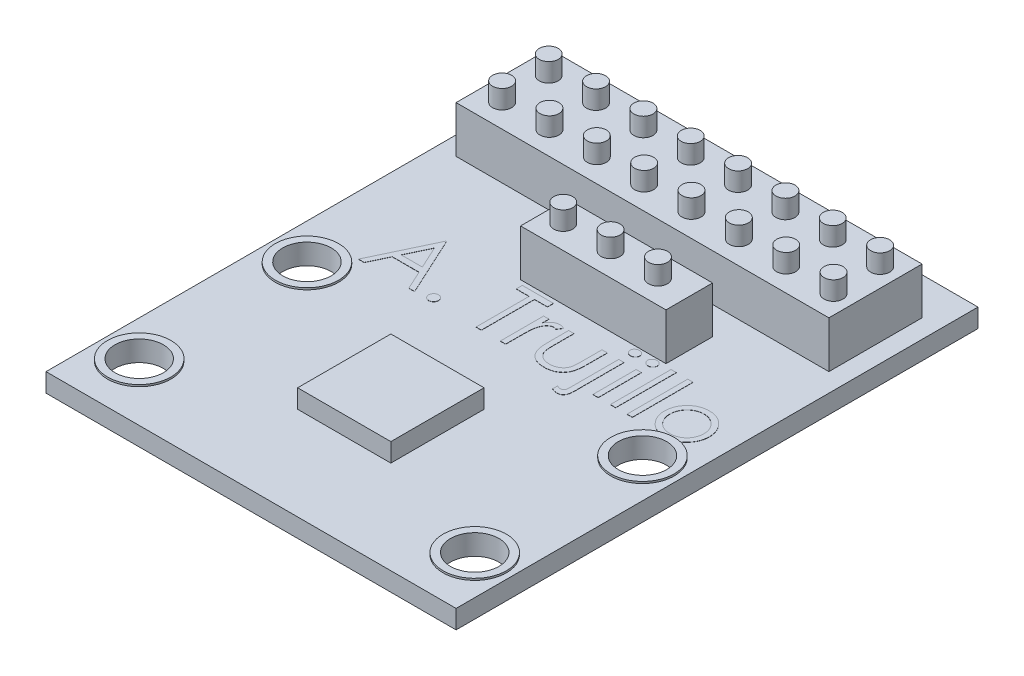
from build123d import *

# Parameters (mm, degrees)
SKETCH1_W           = 22
SKETCH1_H           = 28
BOSS_EXTRUDE1_DEPTH = 1
SKETCH2_W           = 20
SKETCH2_H           = 5
BOSS_EXTRUDE2_DEPTH = 2.5
SKETCH3_R           = 0.51
BOSS_EXTRUDE3_DEPTH = 1
SKETCH4_W           = 5
SKETCH4_H           = 5
BOSS_EXTRUDE4_DEPTH = 1
SKETCH5_R           = 1.3
CUT_EXTRUDE1_DEPTH  = 1
BOSS_EXTRUDE5_START = 0.1
SKETCH6_R           = 1.7
SKETCH6_R_2         = 1.3
BOSS_EXTRUDE5_DEPTH = 0.1
SKETCH7_W           = 7.8
SKETCH7_H           = 2.5
BOSS_EXTRUDE6_DEPTH = 2.5
SKETCH8_R           = 0.51
BOSS_EXTRUDE7_DEPTH = 1
SKETCH9_W           = 0.284935898
SKETCH9_H           = 2.320192308
SKETCH9_W_2         = 0.284935897
SKETCH9_H_2         = 3.256410256
BOSS_EXTRUDE8_DEPTH = 0.01


with BuildPart() as part:
    # Sketch1 → Boss-Extrude1 (new body)
    with BuildSketch(Plane(origin=(0, 0, 0), x_dir=(1, 0, 0), z_dir=(0, 1, 0))):
        Rectangle(SKETCH1_W, SKETCH1_H)
    extrude(amount=BOSS_EXTRUDE1_DEPTH)

    # Sketch2 → Boss-Extrude2 (add)
    with BuildSketch(Plane(origin=(0, 1, 0), x_dir=(1, 0, 0), z_dir=(0, 1, 0))):
        with Locations((0, 9.5)):
            Rectangle(SKETCH2_W, SKETCH2_H)
    extrude(amount=BOSS_EXTRUDE2_DEPTH)

    # Sketch3 → Boss-Extrude3 (add)
    with BuildSketch(Plane(origin=(0, 3.5, 0), x_dir=(1, 0, 0), z_dir=(0, 1, 0))):
        with Locations(Location((9, 8.25, 0), (0, 0, 270))):
            Circle(SKETCH3_R)
        with Locations(Location((6.46, 8.25, 0), (0, 0, 270))):
            Circle(SKETCH3_R)
        with Locations(Location((3.92, 8.25, 0), (0, 0, 270))):
            Circle(SKETCH3_R)
        with Locations(Location((1.38, 8.25, 0), (0, 0, 270))):
            Circle(SKETCH3_R)
        with Locations(Location((-1.16, 8.25, 0), (0, 0, 270))):
            Circle(SKETCH3_R)
        with Locations(Location((-3.7, 8.25, 0), (0, 0, 270))):
            Circle(SKETCH3_R)
        with Locations(Location((-6.24, 8.25, 0), (0, 0, 270))):
            Circle(SKETCH3_R)
        with Locations(Location((-8.78, 8.25, 0), (0, 0, 270))):
            Circle(SKETCH3_R)
        with Locations(Location((-8.78, 10.75, 0), (0, 0, 90))):
            Circle(SKETCH3_R)
        with Locations(Location((-6.24, 10.75, 0), (0, 0, 90))):
            Circle(SKETCH3_R)
        with Locations(Location((-3.7, 10.75, 0), (0, 0, 90))):
            Circle(SKETCH3_R)
        with Locations(Location((-1.16, 10.75, 0), (0, 0, 90))):
            Circle(SKETCH3_R)
        with Locations(Location((1.38, 10.75, 0), (0, 0, 90))):
            Circle(SKETCH3_R)
        with Locations(Location((3.92, 10.75, 0), (0, 0, 90))):
            Circle(SKETCH3_R)
        with Locations(Location((6.46, 10.75, 0), (0, 0, 90))):
            Circle(SKETCH3_R)
        with Locations(Location((9, 10.75, 0), (0, 0, 90))):
            Circle(SKETCH3_R)
    extrude(amount=BOSS_EXTRUDE3_DEPTH)

    # Sketch4 → Boss-Extrude4 (add)
    with BuildSketch(Plane(origin=(0, 1, 0), x_dir=(1, 0, 0), z_dir=(0, 1, 0))):
        with Locations((0, -6.5)):
            Rectangle(SKETCH4_W, SKETCH4_H)
    extrude(amount=BOSS_EXTRUDE4_DEPTH)

    # Sketch5 → Cut-Extrude1 (cut)
    with BuildSketch(Plane(origin=(0, 1, 0), x_dir=(1, 0, 0), z_dir=(0, 1, 0))):
        with Locations(Location((-9, -2, 0), (0, 0, 270))):
            Circle(SKETCH5_R)
        with Locations(Location((9, -2, 0), (0, 0, 90))):
            Circle(SKETCH5_R)
        with Locations(Location((9, -11, 0), (0, 0, 270))):
            Circle(SKETCH5_R)
        with Locations(Location((-9, -11, 0), (0, 0, 90))):
            Circle(SKETCH5_R)
    extrude(amount=-CUT_EXTRUDE1_DEPTH, mode=Mode.SUBTRACT)

    # Sketch6 → Boss-Extrude5 (add)
    # profile 1 of 4: a face of its own
    with BuildSketch(Plane(origin=(0, 1, 0), x_dir=(1, 0, 0), z_dir=(0, 1, 0)).offset(BOSS_EXTRUDE5_START)):
        with Locations(Location((-9, -2, 0), (0, 0, 270))):
            Circle(SKETCH6_R)
        with Locations(Location((-9, -2, 0), (0, 0, 270))):
            Circle(SKETCH6_R_2, mode=Mode.SUBTRACT)
    # profile 2 of 4: a face of its own
    with BuildSketch(Plane(origin=(0, 1, 0), x_dir=(1, 0, 0), z_dir=(0, 1, 0)).offset(BOSS_EXTRUDE5_START)):
        with Locations(Location((9, -2, 0), (0, 0, 270))):
            Circle(SKETCH6_R)
        with Locations(Location((9, -2, 0), (0, 0, 270))):
            Circle(SKETCH6_R_2, mode=Mode.SUBTRACT)
    # profile 3 of 4: a face of its own
    with BuildSketch(Plane(origin=(0, 1, 0), x_dir=(1, 0, 0), z_dir=(0, 1, 0)).offset(BOSS_EXTRUDE5_START)):
        with Locations(Location((-9, -11, 0), (0, 0, 270))):
            Circle(SKETCH6_R)
        with Locations(Location((-9, -11, 0), (0, 0, 270))):
            Circle(SKETCH6_R_2, mode=Mode.SUBTRACT)
    # profile 4 of 4: a face of its own
    with BuildSketch(Plane(origin=(0, 1, 0), x_dir=(1, 0, 0), z_dir=(0, 1, 0)).offset(BOSS_EXTRUDE5_START)):
        with Locations(Location((9, -11, 0), (0, 0, 270))):
            Circle(SKETCH6_R)
        with Locations(Location((9, -11, 0), (0, 0, 270))):
            Circle(SKETCH6_R_2, mode=Mode.SUBTRACT)
    extrude(amount=-BOSS_EXTRUDE5_DEPTH)

    # Sketch7 → Boss-Extrude6 (add)
    with BuildSketch(Plane(origin=(0, 1, 0), x_dir=(1, 0, 0), z_dir=(0, 1, 0))):
        with Locations((1.36, 4.25)):
            Rectangle(SKETCH7_W, SKETCH7_H)
    extrude(amount=BOSS_EXTRUDE6_DEPTH)

    # Sketch8 → Boss-Extrude7 (add)
    with BuildSketch(Plane(origin=(0, 3.5, 0), x_dir=(1, 0, 0), z_dir=(0, 1, 0))):
        with Locations(Location((-1.5, 4.25, 0), (0, 0, 270))):
            Circle(SKETCH8_R)
        with Locations(Location((1.04, 4.25, 0), (0, 0, 270))):
            Circle(SKETCH8_R)
        with Locations(Location((3.58, 4.25, 0), (0, 0, 270))):
            Circle(SKETCH8_R)
    extrude(amount=BOSS_EXTRUDE7_DEPTH)

    # Sketch9 → Boss-Extrude8 (add)
    # profile 1 of 12: a face of its own
    with BuildSketch(Plane(origin=(0, 1, 0), x_dir=(1, 0, 0), z_dir=(0, 1, 0))):
        Polygon((-6.290384615, 2.775), (-4.825, -0.4), (-5.134740585, -0.4), (-5.604121595, 0.617628205), (-7.043429487, 0.617628205), (-7.526166867, -0.4), (-7.837179487, -0.4), (-6.331089744, 2.775), align=None)
        Polygon((-6.313917268, 2.156154848), (-6.888877204, 0.943269231), (-5.754221755, 0.943269231), align=None, mode=Mode.SUBTRACT)
    # profile 2 of 12: a face of its own
    with BuildSketch(Plane(origin=(0, 1, 0), x_dir=(1, 0, 0), z_dir=(0, 1, 0))):
        with BuildLine():
            add(Edge.make_bspline(
                [(-4.03125, 0.088461538), (-4.013569593, 0.087410916), (-3.978909223, 0.085351293), (-3.928799442, 0.071221025), (-3.883447144, 0.046130668), (-3.843050036, 0.012690862), (-3.809752018, -0.027854489), (-3.783767498, -0.072845064), (-3.769760319, -0.123374365), (-3.767715699, -0.158235571), (-3.766666667, -0.176121795)],
                knots=[0, 0, 0, 0, 1.020151414, 1.999887582, 2.974338812, 3.990962822, 5.007586832, 5.987933904, 6.967670073, 8, 8, 8, 8], degree=3))
            add(Edge.make_bspline(
                [(-3.766666667, -0.176121795), (-3.767751247, -0.193578244), (-3.769890025, -0.228002105), (-3.78373539, -0.278150289), (-3.80995005, -0.323168981), (-3.842820365, -0.364264492), (-3.88345713, -0.397775139), (-3.928906662, -0.42265203), (-3.978791589, -0.437794041), (-4.013549968, -0.439722896), (-4.03125, -0.440705128)],
                knots=[0, 0, 0, 0, 1.009421747, 1.99056486, 2.972319754, 3.999869655, 5.017953583, 5.993804169, 6.978383603, 8, 8, 8, 8], degree=3))
            add(Edge.make_bspline(
                [(-4.03125, -0.440705128), (-4.048962786, -0.439758436), (-4.083542784, -0.437910246), (-4.133241507, -0.422341129), (-4.178967828, -0.398008419), (-4.219596681, -0.364202008), (-4.252742295, -0.323380449), (-4.277802464, -0.277840248), (-4.292852099, -0.228145659), (-4.294831369, -0.193606518), (-4.295833333, -0.176121795)],
                knots=[0, 0, 0, 0, 1.022052826, 1.995314843, 2.982371812, 4.00089066, 5.028879526, 6.005146991, 6.990147033, 8, 8, 8, 8], degree=3))
            add(Edge.make_bspline(
                [(-4.295833333, -0.176121795), (-4.294869858, -0.158206286), (-4.292988789, -0.123228454), (-4.277770869, -0.073154978), (-4.252936734, -0.027645037), (-4.219367554, 0.012629004), (-4.178977657, 0.0463632), (-4.133351814, 0.070914834), (-4.083423088, 0.085465779), (-4.048942644, 0.087445633), (-4.03125, 0.088461538)],
                knots=[0, 0, 0, 0, 1.032775665, 2.016367738, 2.991239715, 4.008302682, 5.025365648, 6.011011707, 6.979408107, 8, 8, 8, 8], degree=3))
        make_face()
    # profile 3 of 12: a face of its own
    with BuildSketch(Plane(origin=(0, 1, 0), x_dir=(1, 0, 0), z_dir=(0, 1, 0))):
        Polygon((-2.219871795, 2.449358974), (-2.219871795, 2.775), (-0.550961538, 2.775), (-0.550961538, 2.449358974), (-1.242948718, 2.449358974), (-1.242948718, -0.4), (-1.527884615, -0.4), (-1.527884615, 2.449358974), align=None)
    # profile 4 of 12: a face of its own
    with BuildSketch(Plane(origin=(0, 1, 0), x_dir=(1, 0, 0), z_dir=(0, 1, 0))):
        with BuildLine():
            Line((-0.225320513, 1.920192308), (0.059615385, 1.920192308))
            Line((0.059615385, 1.920192308), (0.059615385, 1.578650841))
            add(Edge.make_bspline(
                [(0.059615385, 1.578650841), (0.080650901, 1.610451486), (0.120881164, 1.671269971), (0.187749321, 1.751705694), (0.256241629, 1.818303629), (0.326685978, 1.871374678), (0.399600397, 1.911119436), (0.473384632, 1.940232403), (0.549199522, 1.957447539), (0.60014641, 1.95974593), (0.625671074, 1.960897436)],
                knots=[0, 0, 0, 0, 1.2804753, 2.448899062, 3.506932113, 4.484331642, 5.4025378, 6.288909075, 7.142734305, 8, 8, 8, 8], degree=3))
            add(Edge.make_bspline(
                [(0.625671074, 1.960897436), (0.64547067, 1.959817458), (0.686209626, 1.957595334), (0.747879547, 1.941982657), (0.811418964, 1.917056165), (0.852369558, 1.893615392), (0.873717949, 1.881395232)],
                knots=[0, 0, 0, 0, 0.901110191, 1.854092781, 2.881294221, 4, 4, 4, 4], degree=3))
            Line((0.873717949, 1.881395232), (0.717257612, 1.634620393))
            add(Edge.make_bspline(
                [(0.717257612, 1.634620393), (0.703551572, 1.640734777), (0.677534883, 1.652341049), (0.639476098, 1.666077015), (0.604386599, 1.674165024), (0.582031371, 1.675390318), (0.571609575, 1.675961538)],
                knots=[0, 0, 0, 0, 1.180555205, 2.24091978, 3.179933427, 4, 4, 4, 4], degree=3))
            add(Edge.make_bspline(
                [(0.571609575, 1.675961538), (0.548744374, 1.674437505), (0.502105992, 1.671328917), (0.433630767, 1.64689157), (0.367185088, 1.607407959), (0.31441508, 1.563619165), (0.273555322, 1.521393663), (0.244399546, 1.484519755), (0.217654483, 1.443173425), (0.192100069, 1.398061498), (0.168817073, 1.348413709), (0.147086766, 1.294726079), (0.127439083, 1.236936427), (0.116235648, 1.196675141), (0.110496795, 1.176051683)],
                knots=[0, 0, 0, 0, 1.125678352, 2.296057538, 3.5422874, 4.923748041, 5.663163013, 6.437101912, 7.23742474, 8.08941207, 8.991984279, 9.93940061, 10.944477711, 12, 12, 12, 12], degree=3))
            add(Edge.make_bspline(
                [(0.110496795, 1.176051683), (0.106203838, 1.15765739), (0.096695265, 1.116915428), (0.087450084, 1.048563552), (0.078315593, 0.967806376), (0.071877946, 0.874419109), (0.065910722, 0.768634964), (0.062545148, 0.650292785), (0.059730156, 0.519271102), (0.059654802, 0.427672938), (0.059615385, 0.379757612)],
                knots=[0, 0, 0, 0, 0.566838948, 1.255505196, 2.06880316, 3.007127437, 4.065329342, 5.249902469, 6.561414163, 8, 8, 8, 8], degree=3))
            Line((0.059615385, 0.379757612), (0.059615385, -0.4))
            Line((0.059615385, -0.4), (-0.225320513, -0.4))
            Line((-0.225320513, -0.4), (-0.225320513, 1.920192308))
        make_face()
    # profile 5 of 12: a face of its own
    with BuildSketch(Plane(origin=(0, 1, 0), x_dir=(1, 0, 0), z_dir=(0, 1, 0))):
        with BuildLine():
            Line((1.117948718, 1.920192308), (1.402884615, 1.920192308))
            Line((1.402884615, 1.920192308), (1.402884615, 0.844050481))
            add(Edge.make_bspline(
                [(1.402884615, 0.844050481), (1.403013343, 0.812461273), (1.403259594, 0.752032597), (1.40492959, 0.665078249), (1.408857604, 0.585778803), (1.413768716, 0.514088448), (1.420084368, 0.450019315), (1.42759856, 0.393795184), (1.435997271, 0.34477846), (1.444218447, 0.315256987), (1.448041867, 0.301527444)],
                knots=[0, 0, 0, 0, 1.388932606, 2.656963016, 3.823490214, 4.879454478, 5.816252168, 6.653371382, 7.373723809, 8, 8, 8, 8], degree=3))
            add(Edge.make_bspline(
                [(1.448041867, 0.301527444), (1.454175473, 0.284270982), (1.466315168, 0.250116817), (1.488334685, 0.200778219), (1.515574676, 0.155080642), (1.545383234, 0.111261947), (1.579763411, 0.070620145), (1.618280217, 0.033223867), (1.659644332, -0.002339845), (1.721107818, -0.044417477), (1.805163009, -0.089516384), (1.915519437, -0.128429019), (2.035175413, -0.15168437), (2.117874837, -0.154382444), (2.160381611, -0.155769231)],
                knots=[0, 0, 0, 0, 0.725840625, 1.436591201, 2.137033971, 2.831655856, 3.53531722, 4.242432219, 4.957935707, 5.694543706, 7.190802206, 8.724350549, 10.316345118, 12, 12, 12, 12], degree=3))
            add(Edge.make_bspline(
                [(2.160381611, -0.155769231), (2.202884435, -0.154352955), (2.285119537, -0.151612724), (2.403460831, -0.129130514), (2.5116389, -0.091569639), (2.608567977, -0.039130058), (2.693808418, 0.025043099), (2.764841712, 0.100343946), (2.823449721, 0.184390176), (2.849039696, 0.247095772), (2.861909054, 0.278630809)],
                knots=[0, 0, 0, 0, 1.157059328, 2.238695713, 3.266970494, 4.264342957, 5.228770407, 6.160125903, 7.074715775, 8, 8, 8, 8], degree=3))
            add(Edge.make_bspline(
                [(2.861909054, 0.278630809), (2.86571382, 0.291300237), (2.874125228, 0.319309249), (2.883162504, 0.366825163), (2.891303623, 0.423489483), (2.898255219, 0.489673001), (2.903212902, 0.565202761), (2.905885369, 0.650055158), (2.90890459, 0.743963821), (2.908950415, 0.809702431), (2.908974359, 0.844050481)],
                knots=[0, 0, 0, 0, 0.557542046, 1.232589297, 2.036731608, 2.971723315, 4.038036528, 5.22795436, 6.551621927, 8, 8, 8, 8], degree=3))
            Line((2.908974359, 0.844050481), (2.908974359, 1.920192308))
            Line((2.908974359, 1.920192308), (3.193910256, 1.920192308))
            Line((3.193910256, 1.920192308), (3.193910256, 0.790625))
            add(Edge.make_bspline(
                [(3.193910256, 0.790625), (3.193509576, 0.752246352), (3.192732202, 0.677786524), (3.187736254, 0.569578794), (3.179164106, 0.468738758), (3.166153241, 0.375213037), (3.150853665, 0.289073036), (3.131117617, 0.210208352), (3.107551645, 0.138861971), (3.080967356, 0.073781931), (3.049560376, 0.014775105), (3.016153008, -0.0412281), (2.977576965, -0.092838119), (2.936963966, -0.142624058), (2.89178675, -0.188109587), (2.842891878, -0.230338425), (2.790967547, -0.269956104), (2.734861489, -0.305417479), (2.675392775, -0.337364007), (2.61248799, -0.36568145), (2.545376656, -0.388090216), (2.474924642, -0.407422034), (2.400786778, -0.422584446), (2.323034536, -0.433276545), (2.241694106, -0.439830953), (2.186259096, -0.440408843), (2.15783754, -0.440705128)],
                knots=[0, 0, 0, 0, 1.493040784, 2.896703357, 4.213163133, 5.428574705, 6.569057535, 7.615249723, 8.588095153, 9.490268104, 10.346124644, 11.18633936, 12.024365274, 12.850166724, 13.684164916, 14.514361689, 15.362232829, 16.222528818, 17.093394965, 17.986930858, 18.902426812, 19.842810585, 20.827885679, 21.843828298, 22.894529745, 24, 24, 24, 24], degree=3))
            add(Edge.make_bspline(
                [(2.15783754, -0.440705128), (2.129628559, -0.440396965), (2.074195286, -0.439791396), (1.992850658, -0.433312757), (1.914882993, -0.422601059), (1.840569489, -0.407310969), (1.769835571, -0.388225527), (1.702394725, -0.365543748), (1.639036636, -0.337349311), (1.579000104, -0.30561967), (1.52275508, -0.269728313), (1.470042299, -0.230387306), (1.42093244, -0.187655377), (1.375414671, -0.141710989), (1.334127899, -0.091984196), (1.296557633, -0.03887501), (1.262125479, 0.017090342), (1.23096259, 0.077019068), (1.204191212, 0.142852249), (1.180555382, 0.215693187), (1.161223589, 0.29634047), (1.145491492, 0.384725148), (1.132835543, 0.480424221), (1.124048828, 0.583991284), (1.119135896, 0.695174061), (1.118352976, 0.771963605), (1.117948718, 0.811613582)],
                knots=[0, 0, 0, 0, 1.083640291, 2.129454052, 3.13281866, 4.105697902, 5.042300162, 5.946461698, 6.836384745, 7.703652036, 8.553297018, 9.397182691, 10.228592656, 11.052265423, 11.879314572, 12.708807002, 13.549817954, 14.402308542, 15.300838682, 16.27712199, 17.341985831, 18.484375296, 19.725102775, 21.0496083, 22.476576903, 24, 24, 24, 24], degree=3))
            Line((1.117948718, 0.811613582), (1.117948718, 1.920192308))
        make_face()
    # profile 6 of 12: a face of its own
    with BuildSketch(Plane(origin=(0, 1, 0), x_dir=(1, 0, 0), z_dir=(0, 1, 0))):
        with BuildLine():
            add(Edge.make_bspline(
                [(3.946955128, 2.897115385), (3.964844632, 2.896301242), (3.999673067, 2.894716217), (4.049844476, 2.881099846), (4.094985299, 2.857386423), (4.135408102, 2.826583645), (4.169313863, 2.789305864), (4.193927924, 2.746840161), (4.208489214, 2.700234886), (4.210508366, 2.668038142), (4.211538462, 2.65161258)],
                knots=[0, 0, 0, 0, 1.06928763, 2.081757757, 3.080304056, 4.102817284, 5.108909582, 6.075019406, 7.017947647, 8, 8, 8, 8], degree=3))
            add(Edge.make_bspline(
                [(4.211538462, 2.65161258), (4.210488325, 2.63561376), (4.20841659, 2.604050893), (4.193938765, 2.558247277), (4.169108267, 2.516376936), (4.135430802, 2.479171593), (4.09497934, 2.448386481), (4.04984607, 2.424668402), (3.999672639, 2.411053277), (3.964844487, 2.409468078), (3.946955128, 2.408653846)],
                knots=[0, 0, 0, 0, 0.962634111, 1.899108286, 2.860048811, 3.872254101, 4.900980094, 5.905593535, 6.924215405, 8, 8, 8, 8], degree=3))
            add(Edge.make_bspline(
                [(3.946955128, 2.408653846), (3.929065769, 2.409468078), (3.894237617, 2.411053277), (3.844064186, 2.424668402), (3.798930916, 2.448386481), (3.758479455, 2.479171593), (3.72480199, 2.516376936), (3.699971492, 2.558247277), (3.685493667, 2.604050893), (3.683421931, 2.63561376), (3.682371795, 2.65161258)],
                knots=[0, 0, 0, 0, 1.075784595, 2.094406465, 3.099019906, 4.127745899, 5.139951189, 6.100891714, 7.037365889, 8, 8, 8, 8], degree=3))
            add(Edge.make_bspline(
                [(3.682371795, 2.65161258), (3.68340189, 2.668038142), (3.685421042, 2.700234886), (3.699982332, 2.746840161), (3.724596393, 2.789305864), (3.758502154, 2.826583645), (3.798924958, 2.857386423), (3.844065781, 2.881099846), (3.89423719, 2.894716217), (3.929065624, 2.896301242), (3.946955128, 2.897115385)],
                knots=[0, 0, 0, 0, 0.982052353, 1.924980594, 2.891090418, 3.897182716, 4.919695944, 5.918242243, 6.93071237, 8, 8, 8, 8], degree=3))
        make_face()
    # profile 7 of 12: a face of its own
    with BuildSketch(Plane(origin=(0, 1, 0), x_dir=(1, 0, 0), z_dir=(0, 1, 0))):
        with BuildLine():
            Line((3.804487179, 1.920192308), (4.089423077, 1.920192308))
            Line((4.089423077, 1.920192308), (4.089423077, -0.738997396))
            add(Edge.make_bspline(
                [(4.089423077, -0.738997396), (4.089332128, -0.762543685), (4.089157362, -0.807790032), (4.08355857, -0.873126571), (4.076295731, -0.933703109), (4.065705325, -0.989449357), (4.051692947, -1.040319581), (4.034491536, -1.085988372), (4.015142869, -1.127421868), (3.991180759, -1.163108424), (3.965126068, -1.194427666), (3.936750989, -1.221527429), (3.906210926, -1.244748826), (3.872788376, -1.262979637), (3.837570782, -1.278101428), (3.799803261, -1.287846972), (3.760003002, -1.294698271), (3.73264868, -1.295236754), (3.7186248, -1.295512821)],
                knots=[0, 0, 0, 0, 1.493029139, 2.868991889, 4.156754484, 5.362105958, 6.464967428, 7.499106053, 8.455465818, 9.358121702, 10.217355437, 11.035397588, 11.842309395, 12.643033568, 13.444773531, 14.266895717, 15.11148054, 16, 16, 16, 16], degree=3))
            add(Edge.make_bspline(
                [(3.7186248, -1.295512821), (3.693966134, -1.294660842), (3.643002913, -1.292900019), (3.564737446, -1.277501864), (3.481894906, -1.254874533), (3.426311346, -1.233483404), (3.397435897, -1.222370793)],
                knots=[0, 0, 0, 0, 0.892368802, 1.844300437, 2.88012224, 4, 4, 4, 4], degree=3))
            Line((3.397435897, -1.222370793), (3.397435897, -0.948247196))
            add(Edge.make_bspline(
                [(3.397435897, -0.948247196), (3.41545271, -0.957855682), (3.449830753, -0.976189721), (3.50244422, -0.994748605), (3.551728083, -1.008347444), (3.584131659, -1.009853719), (3.599689503, -1.010576923)],
                knots=[0, 0, 0, 0, 1.144578483, 2.183980519, 3.128079311, 4, 4, 4, 4], degree=3))
            add(Edge.make_bspline(
                [(3.599689503, -1.010576923), (3.617677073, -1.009421716), (3.652367083, -1.007193836), (3.700738004, -0.987968404), (3.741514316, -0.955337613), (3.76033218, -0.926010723), (3.770142228, -0.910722155)],
                knots=[0, 0, 0, 0, 1.036054724, 1.998088038, 2.956371939, 4, 4, 4, 4], degree=3))
            add(Edge.make_bspline(
                [(3.770142228, -0.910722155), (3.775712416, -0.897297287), (3.788746637, -0.86588314), (3.797650118, -0.807107044), (3.803895746, -0.732378348), (3.804277615, -0.676696339), (3.804487179, -0.646138822)],
                knots=[0, 0, 0, 0, 0.647276487, 1.514624746, 2.636060416, 4, 4, 4, 4], degree=3))
            Line((3.804487179, -0.646138822), (3.804487179, 1.920192308))
        make_face()
    # profile 8 of 12: a face of its own
    with BuildSketch(Plane(origin=(0, 1, 0), x_dir=(1, 0, 0), z_dir=(0, 1, 0))):
        with BuildLine():
            add(Edge.make_bspline(
                [(4.881901042, 2.897115385), (4.89958245, 2.896295189), (4.934206042, 2.894689089), (4.984274221, 2.880935463), (5.02986451, 2.857622177), (5.070302882, 2.826344181), (5.105002808, 2.789560043), (5.129296738, 2.746687593), (5.14491084, 2.700370114), (5.146796387, 2.66806214), (5.14775641, 2.65161258)],
                knots=[0, 0, 0, 0, 1.055194115, 2.066272739, 3.074728998, 4.095836921, 5.109056067, 6.073838105, 7.019297344, 8, 8, 8, 8], degree=3))
            add(Edge.make_bspline(
                [(5.14775641, 2.65161258), (5.146774737, 2.63559003), (5.144834084, 2.603915346), (5.129308798, 2.558400839), (5.104795768, 2.516124096), (5.070325133, 2.479411381), (5.029858614, 2.448150675), (4.984275787, 2.424832805), (4.93420563, 2.411080395), (4.89958231, 2.409474127), (4.881901042, 2.408653846)],
                knots=[0, 0, 0, 0, 0.96129708, 1.900370562, 2.859976407, 3.87933698, 4.906634145, 5.921202961, 6.938410037, 8, 8, 8, 8], degree=3))
            add(Edge.make_bspline(
                [(4.881901042, 2.408653846), (4.864421963, 2.409442807), (4.830401221, 2.410978415), (4.781082729, 2.425102646), (4.735881171, 2.448158655), (4.695363932, 2.479206694), (4.661590828, 2.516349565), (4.637008776, 2.558375039), (4.621519346, 2.603921915), (4.619573861, 2.635592237), (4.618589744, 2.65161258)],
                knots=[0, 0, 0, 0, 1.054934014, 2.053291228, 3.073705704, 4.106921865, 5.123545215, 6.088680038, 7.033164197, 8, 8, 8, 8], degree=3))
            add(Edge.make_bspline(
                [(4.618589744, 2.65161258), (4.619552301, 2.668059851), (4.621442824, 2.700363328), (4.637020386, 2.746713822), (4.661386069, 2.789332756), (4.695386294, 2.826548745), (4.735875219, 2.857614247), (4.781084267, 2.880665637), (4.830400815, 2.894791066), (4.864421826, 2.896326509), (4.881901042, 2.897115385)],
                knots=[0, 0, 0, 0, 0.98631895, 1.937192651, 2.907499808, 3.917963147, 4.944918757, 5.95915025, 6.951458133, 8, 8, 8, 8], degree=3))
        make_face()
    # profile 9 of 12: a face of its own
    with BuildSketch(Plane(origin=(0, 1, 0), x_dir=(1, 0, 0), z_dir=(0, 1, 0))):
        with Locations((4.883173077, 0.760096154)):
            Rectangle(SKETCH9_W, SKETCH9_H)
    # profile 10 of 12: a face of its own
    with BuildSketch(Plane(origin=(0, 1, 0), x_dir=(1, 0, 0), z_dir=(0, 1, 0))):
        with Locations((5.819391025, 1.228205128)):
            Rectangle(SKETCH9_W_2, SKETCH9_H_2)
    # profile 11 of 12: a face of its own
    with BuildSketch(Plane(origin=(0, 1, 0), x_dir=(1, 0, 0), z_dir=(0, 1, 0))):
        with Locations((6.714903846, 1.228205128)):
            Rectangle(SKETCH9_W, SKETCH9_H_2)
    # profile 12 of 12: a face of its own
    with BuildSketch(Plane(origin=(0, 1, 0), x_dir=(1, 0, 0), z_dir=(0, 1, 0))):
        with BuildLine():
            add(Edge.make_bspline(
                [(8.629316907, 1.960897436), (8.672851847, 1.959970435), (8.758213226, 1.958152812), (8.883224665, 1.938726379), (9.002554896, 1.909019841), (9.116660942, 1.867952067), (9.224081438, 1.812904869), (9.326381067, 1.747219298), (9.423279353, 1.669402231), (9.481357387, 1.609205983), (9.51083734, 1.578650841)],
                knots=[0, 0, 0, 0, 1.054011418, 2.066658804, 3.057071809, 4.030435133, 4.997543892, 5.974964718, 6.972108034, 8, 8, 8, 8], degree=3))
            add(Edge.make_bspline(
                [(9.51083734, 1.578650841), (9.53622097, 1.549428154), (9.586496986, 1.49154832), (9.650963745, 1.397699299), (9.706500446, 1.300507922), (9.751007561, 1.198683562), (9.786100404, 1.09311511), (9.811015714, 0.983439714), (9.825835648, 0.869899585), (9.827834053, 0.79278896), (9.828846154, 0.753735978)],
                knots=[0, 0, 0, 0, 1.025258237, 2.030674902, 3.01204498, 3.988269485, 4.97094183, 5.956517959, 6.965070386, 8, 8, 8, 8], degree=3))
            add(Edge.make_bspline(
                [(9.828846154, 0.753735978), (9.827955941, 0.71445664), (9.826196838, 0.636838836), (9.809556557, 0.522521268), (9.783674787, 0.411673108), (9.746634476, 0.304758435), (9.699138192, 0.201450442), (9.641180211, 0.102200351), (9.572353815, 0.006812344), (9.494335904, -0.083903609), (9.408110273, -0.167511532), (9.314569196, -0.240380748), (9.215550894, -0.302811703), (9.109738709, -0.353100451), (8.998098917, -0.392751394), (8.88039072, -0.420600694), (8.756796978, -0.437438793), (8.672407998, -0.439601034), (8.629316907, -0.440705128)],
                knots=[0, 0, 0, 0, 0.998656419, 1.973391657, 2.932242238, 3.890759089, 4.846373663, 5.82037756, 6.809684879, 7.83454468, 8.860553229, 9.859544525, 10.845671541, 11.83227036, 12.833544569, 13.85385346, 14.904124723, 16, 16, 16, 16], degree=3))
            add(Edge.make_bspline(
                [(8.629316907, -0.440705128), (8.586014697, -0.439597329), (8.501205132, -0.437427648), (8.377175134, -0.420666113), (8.259255979, -0.392764228), (8.147470036, -0.352970146), (8.041202925, -0.302810095), (7.941610889, -0.240569491), (7.847993823, -0.167489922), (7.761749951, -0.083909465), (7.68373693, 0.006813853), (7.614909273, 0.102199959), (7.55695162, 0.201450544), (7.509455249, 0.304758408), (7.472414962, 0.411673115), (7.446533185, 0.522521266), (7.429892906, 0.636838836), (7.428133803, 0.71445664), (7.42724359, 0.753735978)],
                knots=[0, 0, 0, 0, 1.099876186, 2.154163076, 3.173186993, 4.173200201, 5.163417411, 6.152872554, 7.150605724, 8.17532212, 9.198891216, 10.186952605, 11.159729845, 12.11414092, 13.071450619, 14.029093627, 15.002601286, 16, 16, 16, 16], degree=3))
            add(Edge.make_bspline(
                [(7.42724359, 0.753735978), (7.428262593, 0.792576701), (7.430280043, 0.869474659), (7.445085077, 0.98280135), (7.469903196, 1.092291124), (7.505038105, 1.197452092), (7.549955457, 1.298830237), (7.604711768, 1.396261763), (7.669836128, 1.48968641), (7.719912184, 1.54749144), (7.745252404, 1.576742788)],
                knots=[0, 0, 0, 0, 1.031353054, 2.041901799, 3.029428768, 4.008703097, 4.981709435, 5.96992636, 6.972712378, 8, 8, 8, 8], degree=3))
            add(Edge.make_bspline(
                [(7.745252404, 1.576742788), (7.774687911, 1.607562912), (7.832578016, 1.668176108), (7.929958648, 1.745766326), (8.032006614, 1.812818764), (8.140614226, 1.866772189), (8.254626533, 1.909261415), (8.374568274, 1.93880299), (8.50000392, 1.958082819), (8.585783005, 1.95994988), (8.629316907, 1.960897436)],
                knots=[0, 0, 0, 0, 1.027980169, 2.021703884, 2.998553061, 3.971491411, 4.943284454, 5.930300938, 6.949603206, 8, 8, 8, 8], degree=3))
        make_face()
        with BuildLine():
            add(Edge.make_bspline(
                [(8.628044872, 1.675961538), (8.59725861, 1.675086516), (8.536480829, 1.67335906), (8.447018777, 1.660220089), (8.360894495, 1.639403425), (8.277944586, 1.609826888), (8.19844878, 1.571637172), (8.122330965, 1.524730303), (8.049367251, 1.469727549), (7.980984951, 1.406714983), (7.918226711, 1.337881895), (7.863364546, 1.264540884), (7.816714628, 1.187881555), (7.777852484, 1.107824192), (7.748908106, 1.023557503), (7.727886865, 0.936035787), (7.714760289, 0.845080731), (7.713049074, 0.78324895), (7.712179487, 0.751827925)],
                knots=[0, 0, 0, 0, 1.021534396, 2.016698045, 2.994645724, 3.958388632, 4.93408049, 5.916473867, 6.921342795, 7.962252576, 8.998418191, 10.008913653, 10.997312074, 11.973003931, 12.956656626, 13.948281152, 14.957379055, 16, 16, 16, 16], degree=3))
            add(Edge.make_bspline(
                [(7.712179487, 0.751827925), (7.713637106, 0.711231443), (7.716530206, 0.630655018), (7.740057171, 0.511990642), (7.779414724, 0.398069962), (7.832561757, 0.289560812), (7.899151684, 0.189165246), (7.977607808, 0.099656113), (8.067088108, 0.022380413), (8.166525933, -0.041737211), (8.273890207, -0.092682133), (8.387515584, -0.128785489), (8.506025357, -0.15225481), (8.587015734, -0.154587505), (8.628044872, -0.155769231)],
                knots=[0, 0, 0, 0, 1.016792936, 2.018143844, 3.017858371, 4.030088057, 5.03801393, 6.028138512, 7.003788237, 7.991172063, 8.984598303, 9.972568034, 10.972917682, 12, 12, 12, 12], degree=3))
            add(Edge.make_bspline(
                [(8.628044872, -0.155769231), (8.669071649, -0.154580619), (8.750057369, -0.152234334), (8.868402479, -0.12890369), (8.981717296, -0.092523941), (9.088970055, -0.041794507), (9.188362617, 0.022623898), (9.278486462, 0.099219754), (9.356272703, 0.189402319), (9.422796758, 0.289693792), (9.476814161, 0.39790174), (9.515987494, 0.512011668), (9.539571018, 0.630649663), (9.542456484, 0.711229649), (9.543910256, 0.751827925)],
                knots=[0, 0, 0, 0, 1.02726834, 2.027799167, 3.010890988, 4.004497153, 4.992059811, 5.971914811, 6.958719428, 7.966827853, 8.981595046, 9.981490638, 10.983022906, 12, 12, 12, 12], degree=3))
            add(Edge.make_bspline(
                [(9.543910256, 0.751827925), (9.543040969, 0.783249138), (9.541330343, 0.845081288), (9.528199482, 0.936033657), (9.5071941, 1.023565319), (9.478191276, 1.107795351), (9.439497992, 1.188088837), (9.391948472, 1.264315804), (9.337310328, 1.338135956), (9.273794797, 1.406492473), (9.205483875, 1.469752114), (9.132490591, 1.524751631), (9.056485646, 1.571431021), (8.977220789, 1.61015354), (8.894260245, 1.639134341), (8.808256635, 1.660340285), (8.719176286, 1.673303535), (8.658616297, 1.675069871), (8.628044872, 1.675961538)],
                knots=[0, 0, 0, 0, 1.042956736, 2.052379634, 3.044323526, 4.02829302, 5.004299113, 5.996692471, 7.007513377, 8.048758398, 9.090003419, 10.095195979, 11.07790575, 12.047570684, 13.018257071, 13.989683339, 14.985167495, 16, 16, 16, 16], degree=3))
        make_face(mode=Mode.SUBTRACT)
    extrude(amount=BOSS_EXTRUDE8_DEPTH)


solid = part.part
